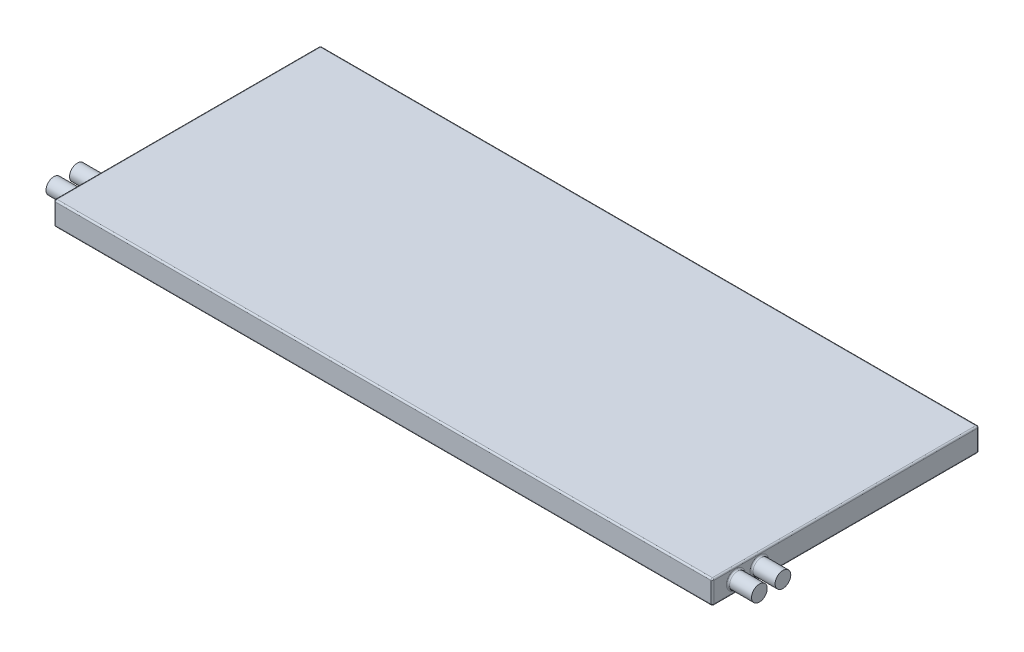
from build123d import *

# Parameters (mm, degrees)
SKETCH1_W           = 42
SKETCH1_H           = 17
BOSS_EXTRUDE1_DEPTH = 1.5
SKETCH2_R           = 0.5
BOSS_EXTRUDE2_DEPTH = 1.5
FILLET1_R           = 0.1


with BuildPart() as part:
    # Sketch1 → Boss-Extrude1 (new body)
    with BuildSketch(Plane(origin=(0, 0, 0), x_dir=(1, 0, 0), z_dir=(0, 1, 0))):
        Rectangle(SKETCH1_W, SKETCH1_H)
    extrude(amount=BOSS_EXTRUDE1_DEPTH)

    # Sketch2 → Boss-Extrude2 (add)
    with BuildSketch(Plane.ZY.offset(21)):
        with Locations(Location((5.5, 0.75, 0), (0, 0, 180))):
            Circle(SKETCH2_R)
        with Locations(Location((7, 0.75, 0), (0, 0, 180))):
            Circle(SKETCH2_R)
    boss_extrude2 = extrude(amount=BOSS_EXTRUDE2_DEPTH)

    # Mirror1: Boss-Extrude2 across plane
    add(boss_extrude2.mirror(Plane(origin=(0, 0, 0), x_dir=(0, 0, 1), z_dir=(1, 0, 0))))

    # Fillet1
    fillet1_edges = [part.edges().sort_by_distance(p)[0] for p in [
        (21, 1.5, 0),
        (-21, 0.75, 7.5),
        (-21, 0.75, 6),
        (0, 1.5, -8.5),
        (21, 0.75, 6),
        (21, 0.75, 7.5),
        (-21, 1.5, 0),
        (0, 0, -8.5),
        (21, 0, 0),
        (0, 0, 8.5),
        (-21, 0, 0),
        (-21, 0.75, -8.5),
        (21, 0.75, -8.5),
        (21, 0.75, 8.5),
        (-21, 0.75, 8.5),
        (0, 1.5, 8.5),
    ]]
    fillet(fillet1_edges, radius=FILLET1_R)


solid = part.part
